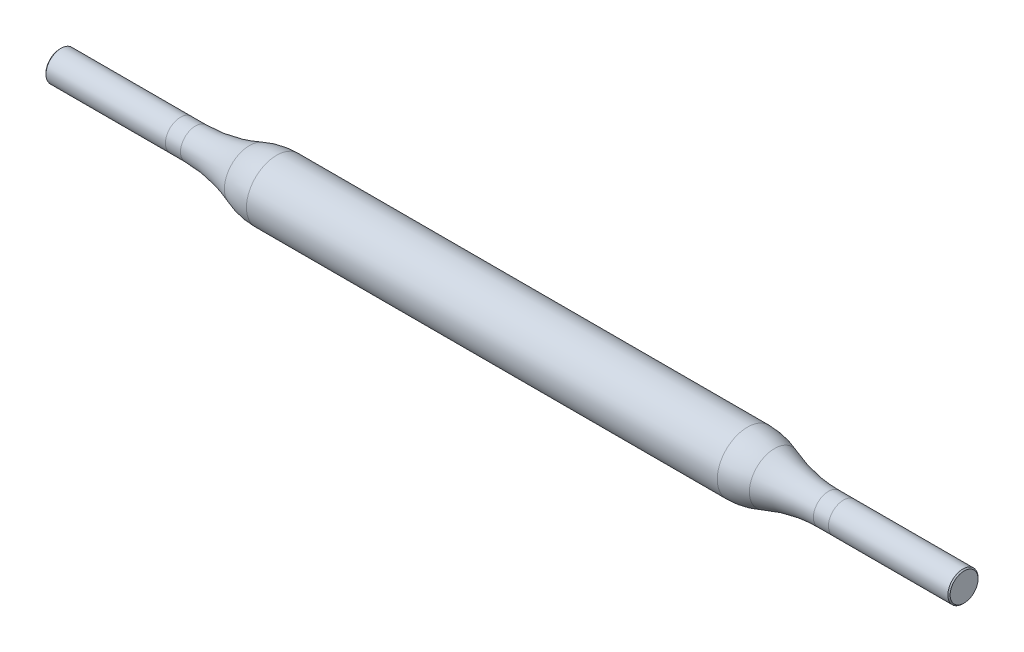
from build123d import *

# Parameters (mm, degrees)
CHAMFER1_SIZE = 0.075


with BuildPart() as part:
    # Sketch1 → Revolve1 (revolve)
    with BuildSketch(Plane(origin=(0, 0, 0), x_dir=(1, 0, 0), z_dir=(0, 1, 0)), mode=Mode.PRIVATE) as revolve1_sk:
        with BuildLine():
            Line((-30, 0), (30, 0))
            Line((30, 0), (30, 1))
            Line((30, 1), (21, 1))
            ThreePointArc((21, 1), (19.178802434, 1.167873273), (17.418979879, 1.665835704))
            ThreePointArc((17.418979879, 1.665835704), (16.535774215, 1.915749105), (15.621766151, 2))
            Line((15.621766151, 2), (-15.621766151, 2))
            ThreePointArc((-15.621766151, 2), (-16.535774215, 1.915749105), (-17.418979879, 1.665835704))
            ThreePointArc((-17.418979879, 1.665835704), (-19.178802434, 1.167873273), (-21, 1))
            Line((-21, 1), (-30, 1))
            Line((-30, 1), (-30, 0))
        make_face()
    revolve(revolve1_sk.sketch.rotate(Axis((-30, 0, 0), (1, 0, 0)), 180), axis=Axis((-30, 0, 0), (1, 0, 0)))

    # Chamfer1
    chamfer1_edges = [part.edges().sort_by_distance(p)[0] for p in [
        (30, 0, -1),
        (-30, 0, -1),
    ]]
    chamfer(chamfer1_edges, length=CHAMFER1_SIZE)


solid = part.part
